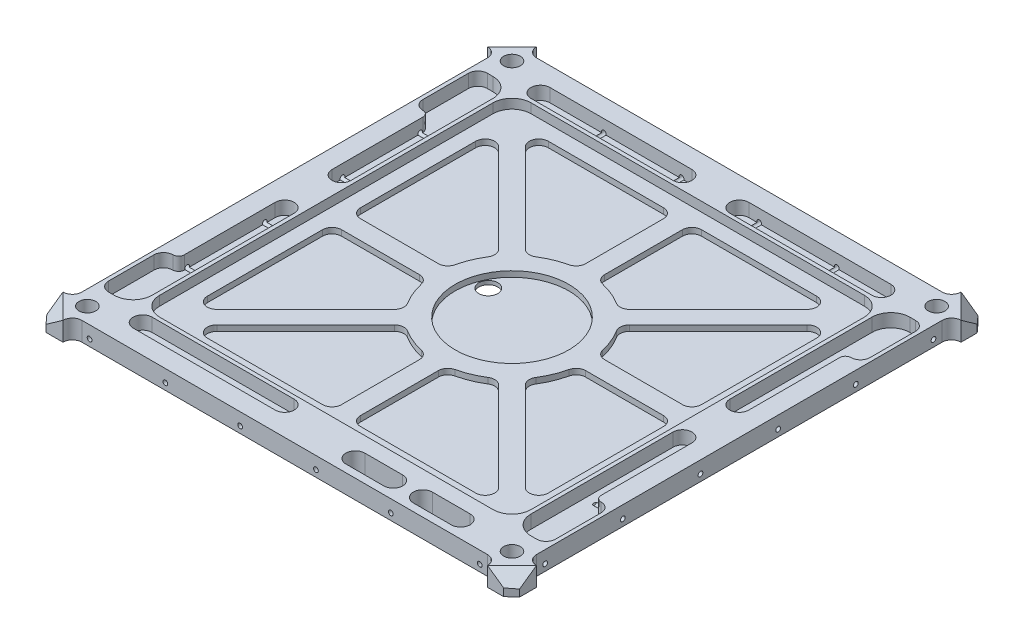
from build123d import *

# Parameters (mm, degrees)
SKETCH1_R                         = 5
BOSS_EXTRUDE1_DEPTH               = 5
CUT_EXTRUDE3_START                = 5
SKETCH2_6_R                       = 30
SKETCH2_6_R_2                     = 5
CUT_EXTRUDE3_DEPTH                = 5
CUT_EXTRUDE2_START                = 8
SKETCH2_R                         = 30
SKETCH2_R_2                       = 5
CUT_EXTRUDE2_DEPTH                = 8
SKETCH3_R                         = 5
SKETCH3_W                         = 75
SKETCH3_H                         = 10
CUT_EXTRUDE4_DEPTH                = 7
CUT_EXTRUDE5_DEPTH                = 7
CUT_EXTRUDE6_DEPTH                = 7
CIRPATTERN1_COUNT                 = 4
TAP_DRILL_FOR_M10X1_25_TAP1_D     = 8.8
TAP_DRILL_FOR_M10X1_25_TAP1_DEPTH = 30
TAP_DRILL_FOR_M10X1_25_TAP1_TIP   = 2.643786724
M3X0_5_TAPPED_HOLE1_D             = 2.5
M3X0_5_TAPPED_HOLE1_DEPTH         = 15
M3X0_5_TAPPED_HOLE1_TIP           = 0.751075774
M3X0_5_TAPPED_HOLE2_D             = 2.5
M3X0_5_TAPPED_HOLE2_DEPTH         = 15
M3X0_5_TAPPED_HOLE2_TIP           = 0.751075774
M3X0_5_TAPPED_HOLE3_D             = 2.5
M3X0_5_TAPPED_HOLE3_DEPTH         = 15
M3X0_5_TAPPED_HOLE3_TIP           = 0.751075774
M3X0_5_TAPPED_HOLE4_D             = 2.5
M3X0_5_TAPPED_HOLE4_DEPTH         = 15
M3X0_5_TAPPED_HOLE4_TIP           = 0.751075774


with BuildPart() as part:
    # Sketch1 → Boss-Extrude1 (new, symmetric)
    with BuildSketch(Plane(origin=(0, 0, 0), x_dir=(1, 0, 0), z_dir=(0, 1, 0))):
        with BuildLine():
            Line((-112.08, 125), (-125, 125))
            Line((-125, 125), (-125, 112.08))
            ThreePointArc((-125, 112.08), (-121.464466094, 110.615533906), (-120, 107.08))
            Line((-120, 107.08), (-120, -107.08))
            ThreePointArc((-120, -107.08), (-121.464466094, -110.615533906), (-125, -112.08))
            Line((-125, -112.08), (-125, -125))
            Line((-125, -125), (-112.08, -125))
            ThreePointArc((-112.08, -125), (-110.615533906, -121.464466094), (-107.08, -120))
            Line((-107.08, -120), (107.08, -120))
            ThreePointArc((107.08, -120), (110.615533906, -121.464466094), (112.08, -125))
            Line((112.08, -125), (125, -125))
            Line((125, -125), (125, -112.08))
            ThreePointArc((125, -112.08), (121.464466094, -110.615533906), (120, -107.08))
            Line((120, -107.08), (120, 107.08))
            ThreePointArc((120, 107.08), (121.464466094, 110.615533906), (125, 112.08))
            Line((125, 112.08), (125, 125))
            Line((125, 125), (112.08, 125))
            ThreePointArc((112.08, 125), (110.615533906, 121.464466094), (107.08, 120))
            Line((107.08, 120), (-107.08, 120))
            ThreePointArc((-107.08, 120), (-110.615533906, 121.464466094), (-112.08, 125))
        make_face()
        with BuildLine():
            Line((48.29, -116), (28.29, -116))
            ThreePointArc((28.29, -116), (23.29, -111), (28.29, -106))
            Line((28.29, -106), (48.29, -106))
            ThreePointArc((48.29, -106), (53.29, -111), (48.29, -116))
        make_face(mode=Mode.SUBTRACT)
        with BuildLine():
            ThreePointArc((63.91, -116), (58.91, -111), (63.91, -106))
            Line((63.91, -106), (83.91, -106))
            ThreePointArc((83.91, -106), (88.91, -111), (83.91, -116))
            Line((83.91, -116), (63.91, -116))
        make_face(mode=Mode.SUBTRACT)
        with Locations(Location((-22.5, 10, 0), (0, 0, 270))):
            Circle(SKETCH1_R, mode=Mode.SUBTRACT)
    extrude(amount=BOSS_EXTRUDE1_DEPTH, both=True)

    # Sketch2<6> → Cut-Extrude3 (cut)
    # profile 1 of 10: a face of its own
    with BuildSketch(Plane.XZ.offset(-5).offset(CUT_EXTRUDE3_START)):
        with BuildLine():
            ThreePointArc((-88, 98), (-95.071067812, 95.071067812), (-98, 88))
            Line((-98, 88), (-98, -88))
            ThreePointArc((-98, -88), (-95.071067812, -95.071067812), (-88, -98))
            Line((-88, -98), (88, -98))
            ThreePointArc((88, -98), (95.071067812, -95.071067812), (98, -88))
            Line((98, -88), (98, 88))
            ThreePointArc((98, 88), (95.071067812, 95.071067812), (88, 98))
            Line((88, 98), (-88, 98))
        make_face()
        Circle(SKETCH2_6_R, mode=Mode.SUBTRACT)
        with BuildLine():
            Line((43.874821937, 5), (85, 5))
            ThreePointArc((85, 5), (88.535533906, 6.464466094), (90, 10))
            Line((90, 10), (90, 70.857864376))
            ThreePointArc((90, 70.857864376), (86.913417162, 75.477262039), (81.464466094, 74.393398282))
            Line((81.464466094, 74.393398282), (67.175144213, 60.104076401))
            Line((67.175144213, 60.104076401), (34.559718021, 27.488650209))
            ThreePointArc((34.559718021, 27.488650209), (33.126605176, 24.512177536), (33.862446157, 21.291658936))
            ThreePointArc((33.862446157, 21.291658936), (36.9551813, 15.307337295), (38.999841722, 8.888888889))
            ThreePointArc((38.999841722, 8.888888889), (40.756774115, 6.0913202), (43.874821937, 5))
        make_face(mode=Mode.SUBTRACT)
        with BuildLine():
            Line((-5, 43.874821937), (-5, 85))
            ThreePointArc((-5, 85), (-6.464466094, 88.535533906), (-10, 90))
            Line((-10, 90), (-70.857864376, 90))
            ThreePointArc((-70.857864376, 90), (-75.477262039, 86.913417162), (-74.393398282, 81.464466094))
            Line((-74.393398282, 81.464466094), (-60.104076401, 67.175144213))
            Line((-60.104076401, 67.175144213), (-27.488650209, 34.559718021))
            ThreePointArc((-27.488650209, 34.559718021), (-24.512177536, 33.126605176), (-21.291658936, 33.862446157))
            ThreePointArc((-21.291658936, 33.862446157), (-15.307337295, 36.9551813), (-8.888888889, 38.999841722))
            ThreePointArc((-8.888888889, 38.999841722), (-6.0913202, 40.756774115), (-5, 43.874821937))
        make_face(mode=Mode.SUBTRACT)
        with BuildLine():
            Line((-67.175144213, 60.104076401), (-81.464466094, 74.393398282))
            ThreePointArc((-81.464466094, 74.393398282), (-86.913417162, 75.477262039), (-90, 70.857864376))
            Line((-90, 70.857864376), (-90, 10))
            ThreePointArc((-90, 10), (-88.535533906, 6.464466094), (-85, 5))
            Line((-85, 5), (-43.874821937, 5))
            ThreePointArc((-43.874821937, 5), (-40.756774115, 6.0913202), (-38.999841722, 8.888888889))
            ThreePointArc((-38.999841722, 8.888888889), (-36.9551813, 15.307337295), (-33.862446157, 21.291658936))
            ThreePointArc((-33.862446157, 21.291658936), (-33.126605176, 24.512177536), (-34.559718021, 27.488650209))
            Line((-34.559718021, 27.488650209), (-67.175144213, 60.104076401))
        make_face(mode=Mode.SUBTRACT)
        with BuildLine():
            Line((60.104076401, 67.175144213), (74.393398282, 81.464466094))
            ThreePointArc((74.393398282, 81.464466094), (75.477262039, 86.913417162), (70.857864376, 90))
            Line((70.857864376, 90), (10, 90))
            ThreePointArc((10, 90), (6.464466094, 88.535533906), (5, 85))
            Line((5, 85), (5, 43.874821937))
            ThreePointArc((5, 43.874821937), (6.0913202, 40.756774115), (8.888888889, 38.999841722))
            ThreePointArc((8.888888889, 38.999841722), (15.307337295, 36.9551813), (21.291658936, 33.862446157))
            ThreePointArc((21.291658936, 33.862446157), (24.512177536, 33.126605176), (27.488650209, 34.559718021))
            Line((27.488650209, 34.559718021), (60.104076401, 67.175144213))
        make_face(mode=Mode.SUBTRACT)
    # profile 2 of 10: a face of its own
    with BuildSketch(Plane.XZ.offset(-5).offset(CUT_EXTRUDE3_START)):
        with BuildLine():
            ThreePointArc((-81.464466094, 74.393398282), (-86.913417162, 75.477262039), (-90, 70.857864376))
            Line((-90, 70.857864376), (-90, 10))
            ThreePointArc((-90, 10), (-88.535533906, 6.464466094), (-85, 5))
            Line((-85, 5), (-43.874821937, 5))
            ThreePointArc((-43.874821937, 5), (-40.756774115, 6.0913202), (-38.999841722, 8.888888889))
            ThreePointArc((-38.999841722, 8.888888889), (-36.9551813, 15.307337295), (-33.862446157, 21.291658936))
            ThreePointArc((-33.862446157, 21.291658936), (-33.126605176, 24.512177536), (-34.559718021, 27.488650209))
            Line((-34.559718021, 27.488650209), (-67.175144213, 60.104076401))
            Line((-67.175144213, 60.104076401), (-81.464466094, 74.393398282))
        make_face()
    # profile 3 of 10: a face of its own
    with BuildSketch(Plane.XZ.offset(-5).offset(CUT_EXTRUDE3_START)):
        with BuildLine():
            ThreePointArc((-5, 85), (-6.464466094, 88.535533906), (-10, 90))
            Line((-10, 90), (-70.857864376, 90))
            ThreePointArc((-70.857864376, 90), (-75.477262039, 86.913417162), (-74.393398282, 81.464466094))
            Line((-74.393398282, 81.464466094), (-60.104076401, 67.175144213))
            Line((-60.104076401, 67.175144213), (-27.488650209, 34.559718021))
            ThreePointArc((-27.488650209, 34.559718021), (-24.512177536, 33.126605176), (-21.291658936, 33.862446157))
            ThreePointArc((-21.291658936, 33.862446157), (-15.307337295, 36.9551813), (-8.888888889, 38.999841722))
            ThreePointArc((-8.888888889, 38.999841722), (-6.0913202, 40.756774115), (-5, 43.874821937))
            Line((-5, 43.874821937), (-5, 85))
        make_face()
    # profile 4 of 10: a face of its own
    with BuildSketch(Plane.XZ.offset(-5).offset(CUT_EXTRUDE3_START)):
        with BuildLine():
            Line((-67.175144213, -60.104076401), (-81.464466094, -74.393398282))
            ThreePointArc((-81.464466094, -74.393398282), (-86.913417162, -75.477262039), (-90, -70.857864376))
            Line((-90, -70.857864376), (-90, -10))
            ThreePointArc((-90, -10), (-88.535533906, -6.464466094), (-85, -5))
            Line((-85, -5), (-43.874821937, -5))
            ThreePointArc((-43.874821937, -5), (-40.756774115, -6.0913202), (-38.999841722, -8.888888889))
            ThreePointArc((-38.999841722, -8.888888889), (-36.9551813, -15.307337295), (-33.862446157, -21.291658936))
            ThreePointArc((-33.862446157, -21.291658936), (-33.126605176, -24.512177536), (-34.559718021, -27.488650209))
            Line((-34.559718021, -27.488650209), (-67.175144213, -60.104076401))
        make_face()
    # profile 5 of 10: a face of its own
    with BuildSketch(Plane.XZ.offset(-5).offset(CUT_EXTRUDE3_START)):
        with BuildLine():
            ThreePointArc((-5, -43.874821937), (-6.0913202, -40.756774115), (-8.888888889, -38.999841722))
            ThreePointArc((-8.888888889, -38.999841722), (-15.307337295, -36.9551813), (-21.291658936, -33.862446157))
            ThreePointArc((-21.291658936, -33.862446157), (-24.512177536, -33.126605176), (-27.488650209, -34.559718021))
            Line((-27.488650209, -34.559718021), (-60.104076401, -67.175144213))
            Line((-60.104076401, -67.175144213), (-74.393398282, -81.464466094))
            ThreePointArc((-74.393398282, -81.464466094), (-75.477262039, -86.913417162), (-70.857864376, -90))
            Line((-70.857864376, -90), (-10, -90))
            ThreePointArc((-10, -90), (-6.464466094, -88.535533906), (-5, -85))
            Line((-5, -85), (-5, -43.874821937))
        make_face()
    # profile 6 of 10: a face of its own
    with BuildSketch(Plane.XZ.offset(-5).offset(CUT_EXTRUDE3_START)):
        Circle(SKETCH2_6_R)
        with Locations(Location((-22.5, -10, 0), (0, 0, 90))):
            Circle(SKETCH2_6_R_2, mode=Mode.SUBTRACT)
    # profile 7 of 10: a face of its own
    with BuildSketch(Plane.XZ.offset(-5).offset(CUT_EXTRUDE3_START)):
        with BuildLine():
            Line((60.104076401, -67.175144213), (27.488650209, -34.559718021))
            ThreePointArc((27.488650209, -34.559718021), (24.512177536, -33.126605176), (21.291658936, -33.862446157))
            ThreePointArc((21.291658936, -33.862446157), (15.307337295, -36.9551813), (8.888888889, -38.999841722))
            ThreePointArc((8.888888889, -38.999841722), (6.0913202, -40.756774115), (5, -43.874821937))
            Line((5, -43.874821937), (5, -85))
            ThreePointArc((5, -85), (6.464466094, -88.535533906), (10, -90))
            Line((10, -90), (70.857864376, -90))
            ThreePointArc((70.857864376, -90), (75.477262039, -86.913417162), (74.393398282, -81.464466094))
            Line((74.393398282, -81.464466094), (60.104076401, -67.175144213))
        make_face()
    # profile 8 of 10: a face of its own
    with BuildSketch(Plane.XZ.offset(-5).offset(CUT_EXTRUDE3_START)):
        with BuildLine():
            ThreePointArc((81.464466094, -74.393398282), (86.913417162, -75.477262039), (90, -70.857864376))
            Line((90, -70.857864376), (90, -10))
            ThreePointArc((90, -10), (88.535533906, -6.464466094), (85, -5))
            Line((85, -5), (43.874821937, -5))
            ThreePointArc((43.874821937, -5), (40.756774115, -6.0913202), (38.999841722, -8.888888889))
            ThreePointArc((38.999841722, -8.888888889), (36.9551813, -15.307337295), (33.862446157, -21.291658936))
            ThreePointArc((33.862446157, -21.291658936), (33.126605176, -24.512177536), (34.559718021, -27.488650209))
            Line((34.559718021, -27.488650209), (67.175144213, -60.104076401))
            Line((67.175144213, -60.104076401), (81.464466094, -74.393398282))
        make_face()
    # profile 9 of 10: a face of its own
    with BuildSketch(Plane.XZ.offset(-5).offset(CUT_EXTRUDE3_START)):
        with BuildLine():
            ThreePointArc((85, 5), (88.535533906, 6.464466094), (90, 10))
            Line((90, 10), (90, 70.857864376))
            ThreePointArc((90, 70.857864376), (86.913417162, 75.477262039), (81.464466094, 74.393398282))
            Line((81.464466094, 74.393398282), (67.175144213, 60.104076401))
            Line((67.175144213, 60.104076401), (34.559718021, 27.488650209))
            ThreePointArc((34.559718021, 27.488650209), (33.126605176, 24.512177536), (33.862446157, 21.291658936))
            ThreePointArc((33.862446157, 21.291658936), (36.9551813, 15.307337295), (38.999841722, 8.888888889))
            ThreePointArc((38.999841722, 8.888888889), (40.756774115, 6.0913202), (43.874821937, 5))
            Line((43.874821937, 5), (85, 5))
        make_face()
    # profile 10 of 10: a face of its own
    with BuildSketch(Plane.XZ.offset(-5).offset(CUT_EXTRUDE3_START)):
        with BuildLine():
            ThreePointArc((74.393398282, 81.464466094), (75.477262039, 86.913417162), (70.857864376, 90))
            Line((70.857864376, 90), (10, 90))
            ThreePointArc((10, 90), (6.464466094, 88.535533906), (5, 85))
            Line((5, 85), (5, 43.874821937))
            ThreePointArc((5, 43.874821937), (6.0913202, 40.756774115), (8.888888889, 38.999841722))
            ThreePointArc((8.888888889, 38.999841722), (15.307337295, 36.9551813), (21.291658936, 33.862446157))
            ThreePointArc((21.291658936, 33.862446157), (24.512177536, 33.126605176), (27.488650209, 34.559718021))
            Line((27.488650209, 34.559718021), (60.104076401, 67.175144213))
            Line((60.104076401, 67.175144213), (74.393398282, 81.464466094))
        make_face()
    extrude(amount=-CUT_EXTRUDE3_DEPTH, mode=Mode.SUBTRACT)

    # Sketch2 → Cut-Extrude2 (cut)
    # profile 1 of 9: a face of its own
    with BuildSketch(Plane.XZ.offset(-5).offset(CUT_EXTRUDE2_START)):
        with BuildLine():
            ThreePointArc((-81.464466094, 74.393398282), (-86.913417162, 75.477262039), (-90, 70.857864376))
            Line((-90, 70.857864376), (-90, 10))
            ThreePointArc((-90, 10), (-88.535533906, 6.464466094), (-85, 5))
            Line((-85, 5), (-43.874821937, 5))
            ThreePointArc((-43.874821937, 5), (-40.756774115, 6.0913202), (-38.999841722, 8.888888889))
            ThreePointArc((-38.999841722, 8.888888889), (-36.9551813, 15.307337295), (-33.862446157, 21.291658936))
            ThreePointArc((-33.862446157, 21.291658936), (-33.126605176, 24.512177536), (-34.559718021, 27.488650209))
            Line((-34.559718021, 27.488650209), (-67.175144213, 60.104076401))
            Line((-67.175144213, 60.104076401), (-81.464466094, 74.393398282))
        make_face()
    # profile 2 of 9: a face of its own
    with BuildSketch(Plane.XZ.offset(-5).offset(CUT_EXTRUDE2_START)):
        with BuildLine():
            Line((-67.175144213, -60.104076401), (-81.464466094, -74.393398282))
            ThreePointArc((-81.464466094, -74.393398282), (-86.913417162, -75.477262039), (-90, -70.857864376))
            Line((-90, -70.857864376), (-90, -10))
            ThreePointArc((-90, -10), (-88.535533906, -6.464466094), (-85, -5))
            Line((-85, -5), (-43.874821937, -5))
            ThreePointArc((-43.874821937, -5), (-40.756774115, -6.0913202), (-38.999841722, -8.888888889))
            ThreePointArc((-38.999841722, -8.888888889), (-36.9551813, -15.307337295), (-33.862446157, -21.291658936))
            ThreePointArc((-33.862446157, -21.291658936), (-33.126605176, -24.512177536), (-34.559718021, -27.488650209))
            Line((-34.559718021, -27.488650209), (-67.175144213, -60.104076401))
        make_face()
    # profile 3 of 9: a face of its own
    with BuildSketch(Plane.XZ.offset(-5).offset(CUT_EXTRUDE2_START)):
        with BuildLine():
            ThreePointArc((-5, -43.874821937), (-6.0913202, -40.756774115), (-8.888888889, -38.999841722))
            ThreePointArc((-8.888888889, -38.999841722), (-15.307337295, -36.9551813), (-21.291658936, -33.862446157))
            ThreePointArc((-21.291658936, -33.862446157), (-24.512177536, -33.126605176), (-27.488650209, -34.559718021))
            Line((-27.488650209, -34.559718021), (-60.104076401, -67.175144213))
            Line((-60.104076401, -67.175144213), (-74.393398282, -81.464466094))
            ThreePointArc((-74.393398282, -81.464466094), (-75.477262039, -86.913417162), (-70.857864376, -90))
            Line((-70.857864376, -90), (-10, -90))
            ThreePointArc((-10, -90), (-6.464466094, -88.535533906), (-5, -85))
            Line((-5, -85), (-5, -43.874821937))
        make_face()
    # profile 4 of 9: a face of its own
    with BuildSketch(Plane.XZ.offset(-5).offset(CUT_EXTRUDE2_START)):
        with BuildLine():
            Line((60.104076401, -67.175144213), (27.488650209, -34.559718021))
            ThreePointArc((27.488650209, -34.559718021), (24.512177536, -33.126605176), (21.291658936, -33.862446157))
            ThreePointArc((21.291658936, -33.862446157), (15.307337295, -36.9551813), (8.888888889, -38.999841722))
            ThreePointArc((8.888888889, -38.999841722), (6.0913202, -40.756774115), (5, -43.874821937))
            Line((5, -43.874821937), (5, -85))
            ThreePointArc((5, -85), (6.464466094, -88.535533906), (10, -90))
            Line((10, -90), (70.857864376, -90))
            ThreePointArc((70.857864376, -90), (75.477262039, -86.913417162), (74.393398282, -81.464466094))
            Line((74.393398282, -81.464466094), (60.104076401, -67.175144213))
        make_face()
    # profile 5 of 9: a face of its own
    with BuildSketch(Plane.XZ.offset(-5).offset(CUT_EXTRUDE2_START)):
        with BuildLine():
            ThreePointArc((81.464466094, -74.393398282), (86.913417162, -75.477262039), (90, -70.857864376))
            Line((90, -70.857864376), (90, -10))
            ThreePointArc((90, -10), (88.535533906, -6.464466094), (85, -5))
            Line((85, -5), (43.874821937, -5))
            ThreePointArc((43.874821937, -5), (40.756774115, -6.0913202), (38.999841722, -8.888888889))
            ThreePointArc((38.999841722, -8.888888889), (36.9551813, -15.307337295), (33.862446157, -21.291658936))
            ThreePointArc((33.862446157, -21.291658936), (33.126605176, -24.512177536), (34.559718021, -27.488650209))
            Line((34.559718021, -27.488650209), (67.175144213, -60.104076401))
            Line((67.175144213, -60.104076401), (81.464466094, -74.393398282))
        make_face()
    # profile 6 of 9: a face of its own
    with BuildSketch(Plane.XZ.offset(-5).offset(CUT_EXTRUDE2_START)):
        with BuildLine():
            ThreePointArc((85, 5), (88.535533906, 6.464466094), (90, 10))
            Line((90, 10), (90, 70.857864376))
            ThreePointArc((90, 70.857864376), (86.913417162, 75.477262039), (81.464466094, 74.393398282))
            Line((81.464466094, 74.393398282), (67.175144213, 60.104076401))
            Line((67.175144213, 60.104076401), (34.559718021, 27.488650209))
            ThreePointArc((34.559718021, 27.488650209), (33.126605176, 24.512177536), (33.862446157, 21.291658936))
            ThreePointArc((33.862446157, 21.291658936), (36.9551813, 15.307337295), (38.999841722, 8.888888889))
            ThreePointArc((38.999841722, 8.888888889), (40.756774115, 6.0913202), (43.874821937, 5))
            Line((43.874821937, 5), (85, 5))
        make_face()
    # profile 7 of 9: a face of its own
    with BuildSketch(Plane.XZ.offset(-5).offset(CUT_EXTRUDE2_START)):
        with BuildLine():
            ThreePointArc((74.393398282, 81.464466094), (75.477262039, 86.913417162), (70.857864376, 90))
            Line((70.857864376, 90), (10, 90))
            ThreePointArc((10, 90), (6.464466094, 88.535533906), (5, 85))
            Line((5, 85), (5, 43.874821937))
            ThreePointArc((5, 43.874821937), (6.0913202, 40.756774115), (8.888888889, 38.999841722))
            ThreePointArc((8.888888889, 38.999841722), (15.307337295, 36.9551813), (21.291658936, 33.862446157))
            ThreePointArc((21.291658936, 33.862446157), (24.512177536, 33.126605176), (27.488650209, 34.559718021))
            Line((27.488650209, 34.559718021), (60.104076401, 67.175144213))
            Line((60.104076401, 67.175144213), (74.393398282, 81.464466094))
        make_face()
    # profile 8 of 9: a face of its own
    with BuildSketch(Plane.XZ.offset(-5).offset(CUT_EXTRUDE2_START)):
        with BuildLine():
            ThreePointArc((-5, 85), (-6.464466094, 88.535533906), (-10, 90))
            Line((-10, 90), (-70.857864376, 90))
            ThreePointArc((-70.857864376, 90), (-75.477262039, 86.913417162), (-74.393398282, 81.464466094))
            Line((-74.393398282, 81.464466094), (-60.104076401, 67.175144213))
            Line((-60.104076401, 67.175144213), (-27.488650209, 34.559718021))
            ThreePointArc((-27.488650209, 34.559718021), (-24.512177536, 33.126605176), (-21.291658936, 33.862446157))
            ThreePointArc((-21.291658936, 33.862446157), (-15.307337295, 36.9551813), (-8.888888889, 38.999841722))
            ThreePointArc((-8.888888889, 38.999841722), (-6.0913202, 40.756774115), (-5, 43.874821937))
            Line((-5, 43.874821937), (-5, 85))
        make_face()
    # profile 9 of 9: a face of its own
    with BuildSketch(Plane.XZ.offset(-5).offset(CUT_EXTRUDE2_START)):
        with Locations(Location((0, 0, 0), (0, 0, 90))):
            Circle(SKETCH2_R)
        with Locations(Location((-22.5, -10, 0), (0, 0, 90))):
            Circle(SKETCH2_R_2, mode=Mode.SUBTRACT)
    extrude(amount=-CUT_EXTRUDE2_DEPTH, mode=Mode.SUBTRACT)

    # Sketch3 → Cut-Extrude4 (cut)
    with BuildSketch(Plane(origin=(0, 5, 0), x_dir=(1, 0, 0), z_dir=(0, 1, 0))):
        with Locations((-15, 105)):
            Circle(SKETCH3_R)
        with Locations((-90, 105)):
            Circle(SKETCH3_R)
        with Locations((-15, -105)):
            Circle(SKETCH3_R)
        with Locations((-90, -105)):
            Circle(SKETCH3_R)
        with Locations((15, 105)):
            Circle(SKETCH3_R)
        with Locations((90, 105)):
            Circle(SKETCH3_R)
        with Locations((-52.5, 105)):
            Rectangle(SKETCH3_W, SKETCH3_H)
        with Locations((52.5, 105)):
            Rectangle(SKETCH3_W, SKETCH3_H)
        with Locations((-52.5, -105)):
            Rectangle(SKETCH3_W, SKETCH3_H)
        with BuildLine():
            Line((-118, 95), (-118, 71))
            ThreePointArc((-118, 71), (-116.535533906, 67.464466094), (-113, 66))
            ThreePointArc((-113, 66), (-110.878679656, 65.121320344), (-110, 63))
            Line((-110, 63), (-110, 15))
            ThreePointArc((-110, 15), (-105, 10), (-100, 15))
            Line((-100, 15), (-100, 60.939030751))
            Line((-100, 60.939030751), (-100, 90))
            ThreePointArc((-100, 90), (-102.928932188, 97.071067812), (-110, 100))
            Line((-110, 100), (-113, 100))
            ThreePointArc((-113, 100), (-116.535533906, 98.535533906), (-118, 95))
        make_face()
        with BuildLine():
            Line((-118, -95), (-118, -71))
            ThreePointArc((-118, -71), (-116.535533906, -67.464466094), (-113, -66))
            ThreePointArc((-113, -66), (-110.878679656, -65.121320344), (-110, -63))
            Line((-110, -63), (-110, -15))
            ThreePointArc((-110, -15), (-105, -10), (-100, -15))
            Line((-100, -15), (-100, -60.939030751))
            Line((-100, -60.939030751), (-100, -90))
            ThreePointArc((-100, -90), (-102.928932188, -97.071067812), (-110, -100))
            Line((-110, -100), (-113, -100))
            ThreePointArc((-113, -100), (-116.535533906, -98.535533906), (-118, -95))
        make_face()
        with BuildLine():
            Line((113, 100), (110, 100))
            ThreePointArc((110, 100), (102.928932188, 97.071067812), (100, 90))
            Line((100, 90), (100, 60.939030751))
            Line((100, 60.939030751), (100, 15))
            ThreePointArc((100, 15), (105, 10), (110, 15))
            Line((110, 15), (110, 63))
            ThreePointArc((110, 63), (110.878679656, 65.121320344), (113, 66))
            ThreePointArc((113, 66), (116.535533906, 67.464466094), (118, 71))
            Line((118, 71), (118, 95))
            ThreePointArc((118, 95), (116.535533906, 98.535533906), (113, 100))
        make_face()
        with BuildLine():
            Line((110, -63), (110, -15))
            ThreePointArc((110, -15), (105, -10), (100, -15))
            Line((100, -15), (100, -60.939030751))
            Line((100, -60.939030751), (100, -90))
            ThreePointArc((100, -90), (102.928932188, -97.071067812), (110, -100))
            Line((110, -100), (113, -100))
            ThreePointArc((113, -100), (116.535533906, -98.535533906), (118, -95))
            Line((118, -95), (118, -71))
            ThreePointArc((118, -71), (116.535533906, -67.464466094), (113, -66))
            ThreePointArc((113, -66), (110.878679656, -65.121320344), (110, -63))
        make_face()
    extrude(amount=-CUT_EXTRUDE4_DEPTH, mode=Mode.SUBTRACT)

    # Sketch8 → Cut-Extrude5 (cut)
    with BuildSketch(Plane(origin=(-61.037766953, 86.320437842, 61.037766953), x_dir=(0.853553390593273, 0.5000000000000012, 0.1464466094067269), z_dir=(-0.5000000000000012, 0.7071067811865462, 0.5000000000000006))):
        Polygon((-74.860437842, -87.780437842), (-87.780437842, -74.860437842), (-93.078262371, -91.894893366), align=None)
    cut_extrude5 = extrude(amount=CUT_EXTRUDE5_DEPTH, mode=Mode.SUBTRACT)

    # Sketch11 → Cut-Extrude6 (cut)
    with BuildSketch(Plane.XZ.offset(5)):
        Polygon((-122.796496271, 123.01038038), (-125, 125), (-125, 120.57), align=None)
        Polygon((-121, 125), (-125, 125), (-122.796496271, 123.01038038), align=None)
    cut_extrude6 = extrude(amount=-CUT_EXTRUDE6_DEPTH, mode=Mode.SUBTRACT)

    # CirPattern1: Cut-Extrude5, Cut-Extrude6 ×4 about axis
    cirpattern1_axis = Axis((0, 0, 0), (0, 1, 0))
    add([cut_extrude5.rotate(cirpattern1_axis, i * 360 / CIRPATTERN1_COUNT) for i in range(1, CIRPATTERN1_COUNT)], mode=Mode.SUBTRACT)
    add([cut_extrude6.rotate(cirpattern1_axis, i * 360 / CIRPATTERN1_COUNT) for i in range(1, CIRPATTERN1_COUNT)], mode=Mode.SUBTRACT)

    # Tap Drill for M10x1.25 Tap1
    with Locations(Plane(origin=(-112.08, 5, -112.08), x_dir=(0, 0, 1), z_dir=(0, 1, 0))):
        with Locations((0, 0), (0, 224.16), (224.16, 224.16), (224.16, 0)):
            Hole(TAP_DRILL_FOR_M10X1_25_TAP1_D / 2, depth=TAP_DRILL_FOR_M10X1_25_TAP1_DEPTH)
            with Locations((0, 0, -(TAP_DRILL_FOR_M10X1_25_TAP1_DEPTH + TAP_DRILL_FOR_M10X1_25_TAP1_TIP / 2))):  # 118° drill point
                Cone(0, TAP_DRILL_FOR_M10X1_25_TAP1_D / 2, TAP_DRILL_FOR_M10X1_25_TAP1_TIP, mode=Mode.SUBTRACT)

    # M3x0.5 Tapped Hole1
    with Locations(Plane.ZY.offset(120)):
        with Locations((-102.5, -1.5), (-61.5, -1.5), (-20.5, -1.5), (20.5, -1.5), (61.5, -1.5), (102.5, -1.5)):
            Hole(M3X0_5_TAPPED_HOLE1_D / 2, depth=M3X0_5_TAPPED_HOLE1_DEPTH)
            with Locations((0, 0, -(M3X0_5_TAPPED_HOLE1_DEPTH + M3X0_5_TAPPED_HOLE1_TIP / 2))):  # 118° drill point
                Cone(0, M3X0_5_TAPPED_HOLE1_D / 2, M3X0_5_TAPPED_HOLE1_TIP, mode=Mode.SUBTRACT)

    # M3x0.5 Tapped Hole2
    with Locations(Plane.XY.offset(120)):
        with Locations((-103, -1.5), (-63, -1.5), (-23.5, -1.5), (16.5, -1.5), (56, -1.5), (103, -1.5)):
            Hole(M3X0_5_TAPPED_HOLE2_D / 2, depth=M3X0_5_TAPPED_HOLE2_DEPTH)
            with Locations((0, 0, -(M3X0_5_TAPPED_HOLE2_DEPTH + M3X0_5_TAPPED_HOLE2_TIP / 2))):  # 118° drill point
                Cone(0, M3X0_5_TAPPED_HOLE2_D / 2, M3X0_5_TAPPED_HOLE2_TIP, mode=Mode.SUBTRACT)

    # M3x0.5 Tapped Hole3
    with Locations(Plane(origin=(120, 0, 0), x_dir=(0, 0, -1), z_dir=(1, 0, 0))):
        with Locations((-102.5, -1.5), (-61.5, -1.5), (-20.5, -1.5), (20.5, -1.5), (61.5, -1.5), (102.5, -1.5)):
            Hole(M3X0_5_TAPPED_HOLE3_D / 2, depth=M3X0_5_TAPPED_HOLE3_DEPTH)
            with Locations((0, 0, -(M3X0_5_TAPPED_HOLE3_DEPTH + M3X0_5_TAPPED_HOLE3_TIP / 2))):  # 118° drill point
                Cone(0, M3X0_5_TAPPED_HOLE3_D / 2, M3X0_5_TAPPED_HOLE3_TIP, mode=Mode.SUBTRACT)

    # M3x0.5 Tapped Hole4
    with Locations(Plane(origin=(0, 0, -120), x_dir=(-1, 0, 0), z_dir=(0, 0, -1))):
        with Locations((-102.5, -1.5), (-61.5, -1.5), (-20.5, -1.5), (20.5, -1.5), (61.5, -1.5), (102.5, -1.5)):
            Hole(M3X0_5_TAPPED_HOLE4_D / 2, depth=M3X0_5_TAPPED_HOLE4_DEPTH)
            with Locations((0, 0, -(M3X0_5_TAPPED_HOLE4_DEPTH + M3X0_5_TAPPED_HOLE4_TIP / 2))):  # 118° drill point
                Cone(0, M3X0_5_TAPPED_HOLE4_D / 2, M3X0_5_TAPPED_HOLE4_TIP, mode=Mode.SUBTRACT)


solid = part.part
